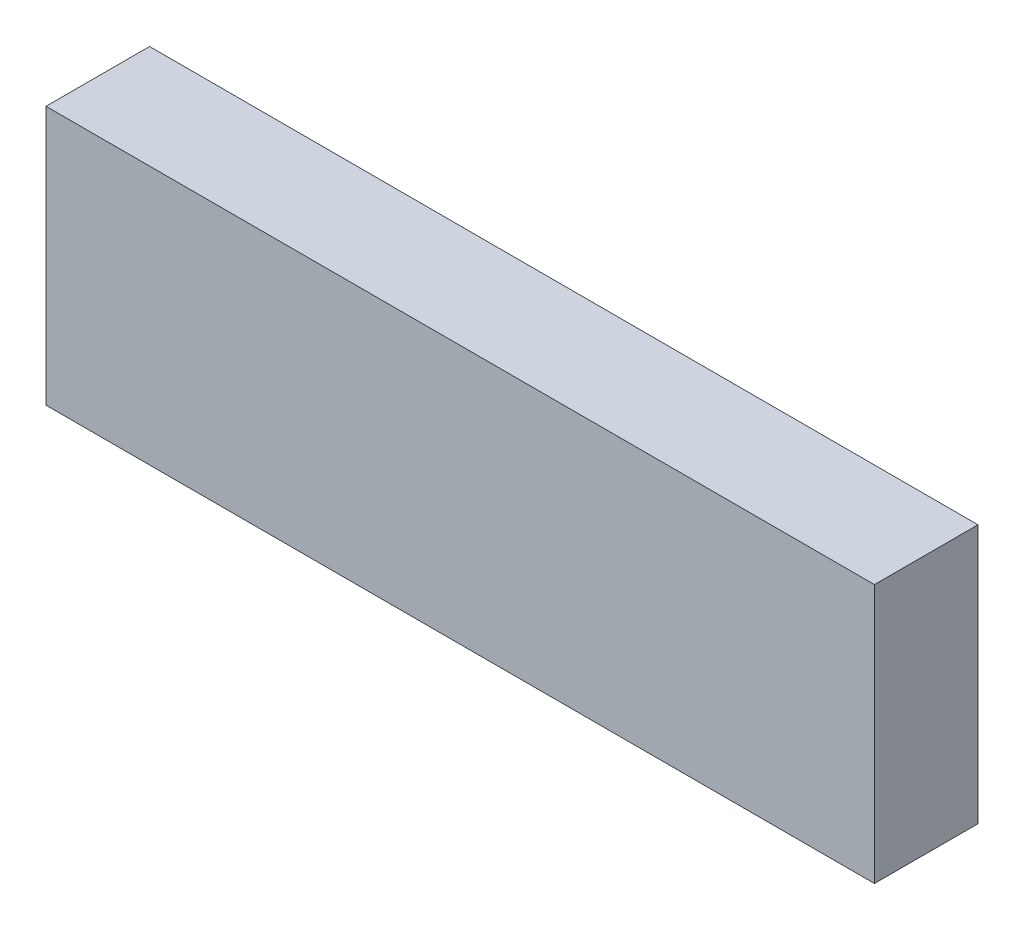
from build123d import *

# Parameters (mm, degrees)
SKETCH1_W           = 25.4
SKETCH1_H           = 7.9375
BOSS_EXTRUDE1_DEPTH = 3.175


with BuildPart() as part:
    # Sketch1 → Boss-Extrude1 (new body)
    with BuildSketch(Plane.XY):
        with Locations((12.7, 3.96875)):
            Rectangle(SKETCH1_W, SKETCH1_H)
    extrude(amount=BOSS_EXTRUDE1_DEPTH)


solid = part.part
